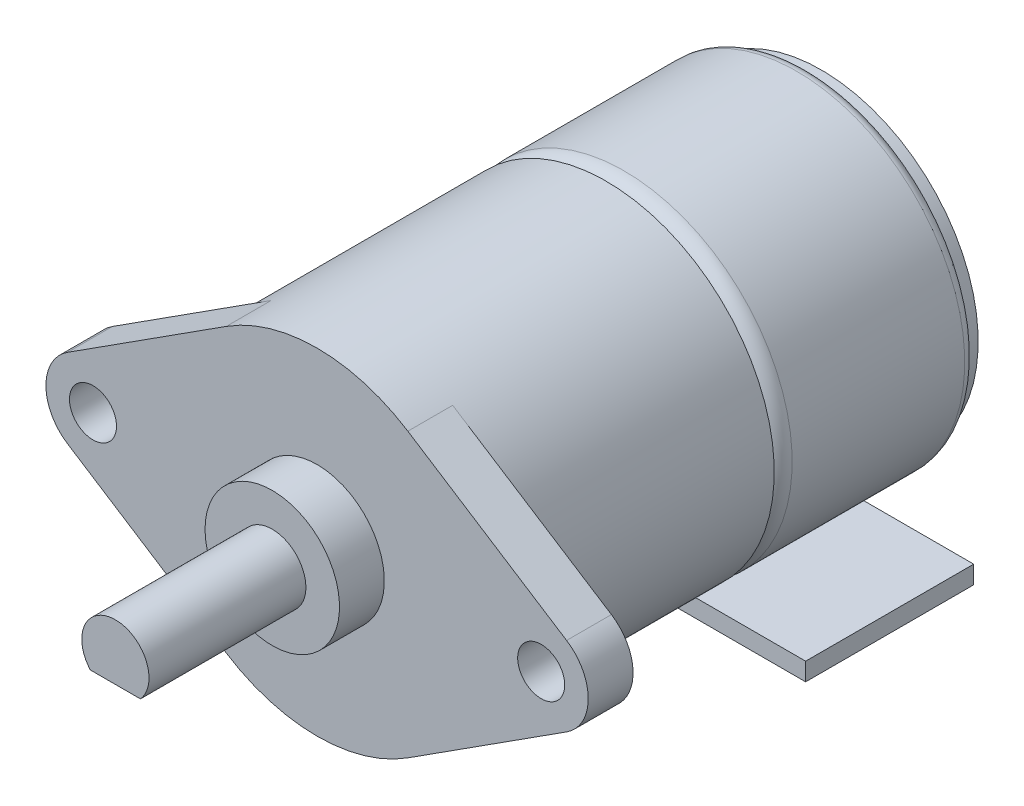
from build123d import *

# Parameters (mm, degrees)
SKETCH_2_W                = 2.236067978
SKETCH_2_H                = 1
CUT_EXTRUDE_1275_DEPTH    = 6.5
SKETCH_3_R                = 1.05
EXTRUDE_1658_DEPTH        = 2
SKETCH_4_W                = 11.5
SKETCH_4_H                = 7.5
EXTRUDE_1897_DEPTH        = 0.8
SKETCH_1932_R             = 0.75
EXTRUDE_3_DEPTH           = 0.7
EXTRUDE_3_DRAFT           = 35
EXTRUDE_3_PROFILE_2_DEPTH = 0.7
EXTRUDE_3_PROFILE_2_DRAFT = 35
EXTRUDE_3_PROFILE_3_DEPTH = 0.7
EXTRUDE_3_PROFILE_3_DRAFT = 35
EXTRUDE_3_PROFILE_4_DEPTH = 0.7
EXTRUDE_3_PROFILE_4_DRAFT = 35
EXTRUDE_3_PROFILE_5_DEPTH = 0.7
EXTRUDE_3_PROFILE_5_DRAFT = 35
EXTRUDE_3_PROFILE_6_DEPTH = 0.7
EXTRUDE_3_PROFILE_6_DRAFT = 35
EXTRUDE_3_PROFILE_7_DEPTH = 0.7
EXTRUDE_3_PROFILE_7_DRAFT = 35
EXTRUDE_3_PROFILE_8_DEPTH = 0.7
EXTRUDE_3_PROFILE_8_DRAFT = 35
EXTRUDE_4_DEPTH           = 0.01


with BuildPart() as part:
    # Эскиз1 → Motor (revolve)
    with BuildSketch(Plane(origin=(0, 0, 0), x_dir=(1, 0, 0), z_dir=(0, 1, 0))):
        with BuildLine():
            Line((0, 0), (-0.75, 0))
            Line((-0.75, 0), (-0.75, -0.5))
            Line((-0.75, -0.5), (-3, -0.5))
            Line((-3, -0.5), (-3, -1.5))
            Line((-3, -1.5), (-7, -1.5))
            Line((-7, -1.5), (-7, -2.1))
            ThreePointArc((-7, -2.1), (-7.353553391, -2.246446609), (-7.5, -2.6))
            Line((-7.5, -2.6), (-7.5, -10.3))
            ThreePointArc((-7.5, -10.3), (-7.265685425, -10.865685425), (-6.7, -11.1))
            Line((-6.7, -11.1), (-7.5, -11.1))
            Line((-7.5, -11.1), (-7.5, -24))
            Line((-7.5, -24), (-3, -24))
            Line((-3, -24), (-3, -26))
            Line((-3, -26), (-1.5, -26))
            Line((-1.5, -26), (-1.5, -33))
            Line((-1.5, -33), (0, -33))
            Line((0, -33), (0, -12))
            Line((0, -12), (0, 0))
        make_face()
    revolve(axis=Axis((0, 0, 0), (0, 0, 1)))

    # Эскиз2 → Cut-Extrude 1275 (cut)
    with BuildSketch(Plane.XY.offset(33)):
        with Locations((0, -1.5)):
            Rectangle(SKETCH_2_W, SKETCH_2_H)
    extrude(amount=-CUT_EXTRUDE_1275_DEPTH, mode=Mode.SUBTRACT)

    # Эскиз3 → Extrude 1658 (add)
    with BuildSketch(Plane.XY.offset(24)):
        with BuildLine():
            Line((4.05, 6.312487624), (11.134, 1.767496535))
            ThreePointArc((11.134, 1.767496535), (12.1, 0), (11.134, -1.767496535))
            Line((11.134, -1.767496535), (4.05, -6.312487624))
            ThreePointArc((4.05, -6.312487624), (0, -7.5), (-4.05, -6.312487624))
            Line((-4.05, -6.312487624), (-11.134, -1.767496535))
            ThreePointArc((-11.134, -1.767496535), (-12.1, 0), (-11.134, 1.767496535))
            Line((-11.134, 1.767496535), (-4.05, 6.312487624))
            ThreePointArc((-4.05, 6.312487624), (0, 7.5), (4.05, 6.312487624))
        make_face()
        with Locations((10, 0)):
            Circle(SKETCH_3_R, mode=Mode.SUBTRACT)
        with Locations((-10, 0)):
            Circle(SKETCH_3_R, mode=Mode.SUBTRACT)
    extrude(amount=-EXTRUDE_1658_DEPTH)


with BuildPart() as body_2:
    # Эскиз4 → Extrude 1897 (new body)
    with BuildSketch(Plane(origin=(0, -7.5, 0), x_dir=(-1, 0, 0), z_dir=(0, -1, 0))):
        with Locations((-2.25, -6.45)):
            Rectangle(SKETCH_4_W, SKETCH_4_H)
    extrude(amount=EXTRUDE_1897_DEPTH)


with BuildPart() as extrude_3_tool:
    # Sketch 1932 → Бобышка-Вытянуть3 (with draft: the straight prism first)
    with BuildSketch(Plane.XZ.offset(8.3)):
        with Locations((-2.25, 5.7)):
            Circle(SKETCH_1932_R)
    extrude(amount=EXTRUDE_3_DEPTH)
    # Бобышка-Вытянуть3: the draft: its side faces are tilted about the plane it starts from
    extrude_3_sides = [extrude_3_tool.faces().sort_by_distance(p)[0] for p in [
        (-3, -8.65, 5.7),
    ]]
    draft(extrude_3_sides, Plane.XZ.offset(8.3), EXTRUDE_3_DRAFT)


with BuildPart() as body_2_1:
    add(body_2.part)

    # Бобышка-Вытянуть3: add extrude_3_tool
    add(extrude_3_tool.part)


with BuildPart() as extrude_3_profile_2_tool:
    # Sketch 1932 → Бобышка-Вытянуть3 profile 2 (with draft: the straight prism first)
    with BuildSketch(Plane.XZ.offset(8.3)):
        with Locations((-0.75, 7.2)):
            Circle(SKETCH_1932_R)
    extrude(amount=EXTRUDE_3_PROFILE_2_DEPTH)
    # Бобышка-Вытянуть3 profile 2: the draft: its side faces are tilted about the plane it starts from
    extrude_3_profile_2_sides = [extrude_3_profile_2_tool.faces().sort_by_distance(p)[0] for p in [
        (-1.5, -8.65, 7.2),
    ]]
    draft(extrude_3_profile_2_sides, Plane.XZ.offset(8.3), EXTRUDE_3_PROFILE_2_DRAFT)


with BuildPart() as body_2_2:
    add(body_2_1.part)

    # Бобышка-Вытянуть3 profile 2: add extrude_3_profile_2_tool
    add(extrude_3_profile_2_tool.part)


with BuildPart() as extrude_3_profile_3_tool:
    # Sketch 1932 → Бобышка-Вытянуть3 profile 3 (with draft: the straight prism first)
    with BuildSketch(Plane.XZ.offset(8.3)):
        with Locations((0.75, 5.7)):
            Circle(SKETCH_1932_R)
    extrude(amount=EXTRUDE_3_PROFILE_3_DEPTH)
    # Бобышка-Вытянуть3 profile 3: the draft: its side faces are tilted about the plane it starts from
    extrude_3_profile_3_sides = [extrude_3_profile_3_tool.faces().sort_by_distance(p)[0] for p in [
        (0, -8.65, 5.7),
    ]]
    draft(extrude_3_profile_3_sides, Plane.XZ.offset(8.3), EXTRUDE_3_PROFILE_3_DRAFT)


with BuildPart() as body_2_3:
    add(body_2_2.part)

    # Бобышка-Вытянуть3 profile 3: add extrude_3_profile_3_tool
    add(extrude_3_profile_3_tool.part)


with BuildPart() as extrude_3_profile_4_tool:
    # Sketch 1932 → Бобышка-Вытянуть3 profile 4 (with draft: the straight prism first)
    with BuildSketch(Plane.XZ.offset(8.3)):
        with Locations((2.25, 7.2)):
            Circle(SKETCH_1932_R)
    extrude(amount=EXTRUDE_3_PROFILE_4_DEPTH)
    # Бобышка-Вытянуть3 profile 4: the draft: its side faces are tilted about the plane it starts from
    extrude_3_profile_4_sides = [extrude_3_profile_4_tool.faces().sort_by_distance(p)[0] for p in [
        (1.5, -8.65, 7.2),
    ]]
    draft(extrude_3_profile_4_sides, Plane.XZ.offset(8.3), EXTRUDE_3_PROFILE_4_DRAFT)


with BuildPart() as body_2_4:
    add(body_2_3.part)

    # Бобышка-Вытянуть3 profile 4: add extrude_3_profile_4_tool
    add(extrude_3_profile_4_tool.part)


with BuildPart() as extrude_3_profile_5_tool:
    # Sketch 1932 → Бобышка-Вытянуть3 profile 5 (with draft: the straight prism first)
    with BuildSketch(Plane.XZ.offset(8.3)):
        with Locations((7, 3.7)):
            Circle(SKETCH_1932_R)
    extrude(amount=EXTRUDE_3_PROFILE_5_DEPTH)
    # Бобышка-Вытянуть3 profile 5: the draft: its side faces are tilted about the plane it starts from
    extrude_3_profile_5_sides = [extrude_3_profile_5_tool.faces().sort_by_distance(p)[0] for p in [
        (6.25, -8.65, 3.7),
    ]]
    draft(extrude_3_profile_5_sides, Plane.XZ.offset(8.3), EXTRUDE_3_PROFILE_5_DRAFT)


with BuildPart() as body_2_5:
    add(body_2_4.part)

    # Бобышка-Вытянуть3 profile 5: add extrude_3_profile_5_tool
    add(extrude_3_profile_5_tool.part)


with BuildPart() as extrude_3_profile_6_tool:
    # Sketch 1932 → Бобышка-Вытянуть3 profile 6 (with draft: the straight prism first)
    with BuildSketch(Plane.XZ.offset(8.3)):
        with Locations((7, 5.533333333)):
            Circle(SKETCH_1932_R)
    extrude(amount=EXTRUDE_3_PROFILE_6_DEPTH)
    # Бобышка-Вытянуть3 profile 6: the draft: its side faces are tilted about the plane it starts from
    extrude_3_profile_6_sides = [extrude_3_profile_6_tool.faces().sort_by_distance(p)[0] for p in [
        (6.25, -8.65, 5.533333333),
    ]]
    draft(extrude_3_profile_6_sides, Plane.XZ.offset(8.3), EXTRUDE_3_PROFILE_6_DRAFT)


with BuildPart() as body_2_6:
    add(body_2_5.part)

    # Бобышка-Вытянуть3 profile 6: add extrude_3_profile_6_tool
    add(extrude_3_profile_6_tool.part)


with BuildPart() as extrude_3_profile_7_tool:
    # Sketch 1932 → Бобышка-Вытянуть3 profile 7 (with draft: the straight prism first)
    with BuildSketch(Plane.XZ.offset(8.3)):
        with Locations((7, 7.366666667)):
            Circle(SKETCH_1932_R)
    extrude(amount=EXTRUDE_3_PROFILE_7_DEPTH)
    # Бобышка-Вытянуть3 profile 7: the draft: its side faces are tilted about the plane it starts from
    extrude_3_profile_7_sides = [extrude_3_profile_7_tool.faces().sort_by_distance(p)[0] for p in [
        (6.25, -8.65, 7.366666667),
    ]]
    draft(extrude_3_profile_7_sides, Plane.XZ.offset(8.3), EXTRUDE_3_PROFILE_7_DRAFT)


with BuildPart() as body_2_7:
    add(body_2_6.part)

    # Бобышка-Вытянуть3 profile 7: add extrude_3_profile_7_tool
    add(extrude_3_profile_7_tool.part)


with BuildPart() as extrude_3_profile_8_tool:
    # Sketch 1932 → Бобышка-Вытянуть3 profile 8 (with draft: the straight prism first)
    with BuildSketch(Plane.XZ.offset(8.3)):
        with Locations((7, 9.2)):
            Circle(SKETCH_1932_R)
    extrude(amount=EXTRUDE_3_PROFILE_8_DEPTH)
    # Бобышка-Вытянуть3 profile 8: the draft: its side faces are tilted about the plane it starts from
    extrude_3_profile_8_sides = [extrude_3_profile_8_tool.faces().sort_by_distance(p)[0] for p in [
        (6.25, -8.65, 9.2),
    ]]
    draft(extrude_3_profile_8_sides, Plane.XZ.offset(8.3), EXTRUDE_3_PROFILE_8_DRAFT)


with BuildPart() as body_2_8:
    add(body_2_7.part)

    # Бобышка-Вытянуть3 profile 8: add extrude_3_profile_8_tool
    add(extrude_3_profile_8_tool.part)

    # Эскиз6 → Бобышка-Вытянуть4 (add)
    # profile 1 of 16: a face of its own
    with BuildSketch(Plane.XZ.offset(8.3)):
        with BuildLine():
            Line((5.183226347, 9.305128205), (5.183226347, 9.228846154))
            add(Edge.make_bspline(
                [(5.183226347, 9.228846154), (5.173106274, 9.22934332), (5.153230721, 9.23031974), (5.124252058, 9.234892324), (5.096553035, 9.241435109), (5.070356056, 9.250685891), (5.045429488, 9.262174558), (5.021872342, 9.27595185), (4.999774482, 9.292270357), (4.979340763, 9.310777707), (4.96059521, 9.330878662), (4.944407508, 9.352567247), (4.930730359, 9.375358182), (4.919296343, 9.399182322), (4.910713809, 9.424308459), (4.904345697, 9.450508582), (4.900514298, 9.4778978), (4.900102465, 9.496558949), (4.899893013, 9.506049679)],
                knots=[0, 0, 0, 0, 1.10065271, 2.161652631, 3.183658789, 4.190468796, 5.17591951, 6.163126047, 7.15150782, 8.156236427, 9.156009102, 10.134482811, 11.092018607, 12.041330605, 13.001268258, 13.972401359, 14.968799086, 16, 16, 16, 16], degree=3))
            add(Edge.make_bspline(
                [(4.899893013, 9.506049679), (4.900109439, 9.515370725), (4.900534708, 9.533686246), (4.904241722, 9.560406313), (4.909922389, 9.585903666), (4.918340243, 9.609889343), (4.928902809, 9.632609504), (4.942038744, 9.653782836), (4.957126498, 9.673921332), (4.974923245, 9.69203663), (4.993912419, 9.708677717), (5.014192696, 9.723021328), (5.035163128, 9.735374158), (5.056987523, 9.745484564), (5.079736952, 9.753148701), (5.10319331, 9.758827092), (5.127627297, 9.762073168), (5.144167936, 9.762568621), (5.152577308, 9.762820513)],
                knots=[0, 0, 0, 0, 1.111674182, 2.184400057, 3.212814286, 4.223731311, 5.211378316, 6.196328225, 7.191884489, 8.207283132, 9.220262353, 10.201199469, 11.166417575, 12.120932471, 13.06540007, 14.026332106, 14.996573967, 16, 16, 16, 16], degree=3))
            add(Edge.make_bspline(
                [(5.152577308, 9.762820513), (5.164416063, 9.762409285), (5.187885819, 9.761594047), (5.222375218, 9.75462065), (5.255790478, 9.743728994), (5.282684739, 9.730616512), (5.304353679, 9.717384889), (5.322203622, 9.705473201), (5.341418154, 9.691449296), (5.362075046, 9.675432988), (5.383903778, 9.657148454), (5.407349714, 9.637070722), (5.431979324, 9.614681279), (5.448812639, 9.598980897), (5.457535241, 9.590845353)],
                knots=[0, 0, 0, 0, 1.184416499, 2.348048165, 3.509039915, 4.696071444, 5.333504901, 6.05069495, 6.844171097, 7.714965912, 8.667477798, 9.695072654, 10.805644396, 12, 12, 12, 12], degree=3))
            Line((5.457535241, 9.590845353), (5.684508398, 9.37817508))
            Line((5.684508398, 9.37817508), (5.684508398, 9.773717949))
            Line((5.684508398, 9.773717949), (5.771687885, 9.773717949))
            Line((5.771687885, 9.773717949), (5.771687885, 9.196153846))
            Line((5.771687885, 9.196153846), (5.419905033, 9.525801282))
            add(Edge.make_bspline(
                [(5.419905033, 9.525801282), (5.411526873, 9.533827197), (5.395434141, 9.549243338), (5.371939423, 9.571047678), (5.350143106, 9.590631433), (5.330086372, 9.608121371), (5.311475849, 9.623138079), (5.294914278, 9.636464193), (5.279673911, 9.647141551), (5.262008334, 9.658729575), (5.240439628, 9.669952971), (5.214081446, 9.6795974), (5.186947685, 9.685478149), (5.168611476, 9.686183609), (5.159388206, 9.686538462)],
                knots=[0, 0, 0, 0, 1.329631726, 2.553950428, 3.673215718, 4.687767853, 5.603093632, 6.413772471, 7.123043292, 7.734684054, 8.834405432, 9.900288307, 10.943827018, 12, 12, 12, 12], degree=3))
            add(Edge.make_bspline(
                [(5.159388206, 9.686538462), (5.153588438, 9.686384067), (5.142158208, 9.686079785), (5.125399667, 9.683394344), (5.109233926, 9.679336078), (5.093611262, 9.673520801), (5.078688746, 9.665844879), (5.064448215, 9.656501344), (5.050680895, 9.6457209), (5.037772237, 9.633249877), (5.025949658, 9.619549937), (5.015476666, 9.605077047), (5.006724311, 9.589764879), (4.999549462, 9.573677992), (4.993921155, 9.556861236), (4.990021214, 9.539282083), (4.987572611, 9.520989108), (4.987241312, 9.508498116), (4.987072501, 9.502133413)],
                knots=[0, 0, 0, 0, 0.991446411, 1.95395049, 2.89581595, 3.838931463, 4.798493298, 5.75982156, 6.748411868, 7.785213223, 8.824556874, 9.840280684, 10.836137867, 11.835679398, 12.848801643, 13.863922112, 14.911575587, 16, 16, 16, 16], degree=3))
            add(Edge.make_bspline(
                [(4.987072501, 9.502133413), (4.987239299, 9.495484543), (4.987566864, 9.482427259), (4.990048006, 9.463296967), (4.993809418, 9.444921487), (4.999783361, 9.427574998), (5.006841872, 9.410881872), (5.015808949, 9.395198482), (5.026228891, 9.380264435), (5.03831124, 9.366325367), (5.051886632, 9.353594562), (5.066847651, 9.342251598), (5.08308659, 9.332405907), (5.1005368, 9.323803635), (5.119372022, 9.316820921), (5.139521114, 9.311484355), (5.160897794, 9.307261899), (5.175659878, 9.305851249), (5.183226347, 9.305128205)],
                knots=[0, 0, 0, 0, 1.030878251, 2.024474673, 2.987898669, 3.934362936, 4.864849709, 5.795128259, 6.730474222, 7.685293701, 8.650606017, 9.611896181, 10.591709709, 11.591680886, 12.625074257, 13.701333388, 14.821793024, 16, 16, 16, 16], degree=3))
        make_face()
    # profile 2 of 16: a face of its own
    with BuildSketch(Plane.XZ.offset(8.3)):
        Polygon((4.921687885, 8.749358974), (5.771687885, 9.141666667), (5.771687885, 9.05874399), (5.499251988, 8.933082933), (5.499251988, 8.54775641), (5.771687885, 8.418519631), (5.771687885, 8.33525641), (4.921687885, 8.738461538), align=None)
        Polygon((5.087362965, 8.743058894), (5.412072501, 8.589132612), (5.412072501, 8.892898638), align=None, mode=Mode.SUBTRACT)
    # profile 3 of 16: a face of its own
    with BuildSketch(Plane.XZ.offset(8.3)):
        Polygon((4.921687885, 7.524248798), (4.921687885, 7.681410256), (5.771687885, 7.681410256), (5.771687885, 7.605128205), (5.008867372, 7.605128205), (5.008867372, 7.474358974), align=None)
    # profile 4 of 16: a face of its own
    with BuildSketch(Plane.XZ.offset(8.3)):
        Polygon((4.921687885, 6.896794872), (5.771687885, 7.289102564), (5.771687885, 7.206179888), (5.499251988, 7.08051883), (5.499251988, 6.695192308), (5.771687885, 6.565955529), (5.771687885, 6.482692308), (4.921687885, 6.885897436), align=None)
        Polygon((5.087362965, 6.890494792), (5.412072501, 6.73656851), (5.412072501, 7.040334535), align=None, mode=Mode.SUBTRACT)
    # profile 5 of 16: a face of its own
    with BuildSketch(Plane.XZ.offset(8.3)):
        with BuildLine():
            Line((5.183226347, 5.6), (5.183226347, 5.523717949))
            add(Edge.make_bspline(
                [(5.183226347, 5.523717949), (5.173106274, 5.524215114), (5.153230721, 5.525191535), (5.124252058, 5.529764119), (5.096553035, 5.536306904), (5.070356056, 5.545557685), (5.045429488, 5.557046353), (5.021872342, 5.570823645), (4.999774482, 5.587142152), (4.979340763, 5.605649501), (4.96059521, 5.625750457), (4.944407508, 5.647439042), (4.930730359, 5.670229977), (4.919296343, 5.694054117), (4.910713809, 5.719180254), (4.904345697, 5.745380376), (4.900514298, 5.772769595), (4.900102465, 5.791430743), (4.899893013, 5.800921474)],
                knots=[0, 0, 0, 0, 1.10065271, 2.161652631, 3.183658789, 4.190468796, 5.17591951, 6.163126047, 7.15150782, 8.156236427, 9.156009102, 10.134482811, 11.092018607, 12.041330605, 13.001268258, 13.972401359, 14.968799086, 16, 16, 16, 16], degree=3))
            add(Edge.make_bspline(
                [(4.899893013, 5.800921474), (4.900109439, 5.81024252), (4.900534708, 5.828558041), (4.904241722, 5.855278108), (4.909922389, 5.880775461), (4.918340243, 5.904761137), (4.928902809, 5.927481298), (4.942038744, 5.94865463), (4.957126498, 5.968793127), (4.974923245, 5.986908425), (4.993912419, 6.003549512), (5.014192696, 6.017893123), (5.035163128, 6.030245953), (5.056987523, 6.040356359), (5.079736952, 6.048020496), (5.10319331, 6.053698887), (5.127627297, 6.056944963), (5.144167936, 6.057440416), (5.152577308, 6.057692308)],
                knots=[0, 0, 0, 0, 1.111674182, 2.184400057, 3.212814286, 4.223731311, 5.211378316, 6.196328225, 7.191884489, 8.207283132, 9.220262353, 10.201199469, 11.166417575, 12.120932471, 13.06540007, 14.026332106, 14.996573967, 16, 16, 16, 16], degree=3))
            add(Edge.make_bspline(
                [(5.152577308, 6.057692308), (5.164416063, 6.05728108), (5.187885819, 6.056465842), (5.222375218, 6.049492445), (5.255790478, 6.038600789), (5.282684739, 6.025488307), (5.304353679, 6.012256684), (5.322203622, 6.000344996), (5.341418154, 5.986321091), (5.362075046, 5.970304783), (5.383903778, 5.952020248), (5.407349714, 5.931942517), (5.431979324, 5.909553074), (5.448812639, 5.893852692), (5.457535241, 5.885717147)],
                knots=[0, 0, 0, 0, 1.184416499, 2.348048165, 3.509039915, 4.696071444, 5.333504901, 6.05069495, 6.844171097, 7.714965912, 8.667477798, 9.695072654, 10.805644396, 12, 12, 12, 12], degree=3))
            Line((5.457535241, 5.885717147), (5.684508398, 5.673046875))
            Line((5.684508398, 5.673046875), (5.684508398, 6.068589744))
            Line((5.684508398, 6.068589744), (5.771687885, 6.068589744))
            Line((5.771687885, 6.068589744), (5.771687885, 5.491025641))
            Line((5.771687885, 5.491025641), (5.419905033, 5.820673077))
            add(Edge.make_bspline(
                [(5.419905033, 5.820673077), (5.411526873, 5.828698992), (5.395434141, 5.844115133), (5.371939423, 5.865919473), (5.350143106, 5.885503228), (5.330086372, 5.902993166), (5.311475849, 5.918009874), (5.294914278, 5.931335988), (5.279673911, 5.942013346), (5.262008334, 5.95360137), (5.240439628, 5.964824766), (5.214081446, 5.974469195), (5.186947685, 5.980349944), (5.168611476, 5.981055404), (5.159388206, 5.981410256)],
                knots=[0, 0, 0, 0, 1.329631726, 2.553950428, 3.673215718, 4.687767853, 5.603093632, 6.413772471, 7.123043292, 7.734684054, 8.834405432, 9.900288307, 10.943827018, 12, 12, 12, 12], degree=3))
            add(Edge.make_bspline(
                [(5.159388206, 5.981410256), (5.153588438, 5.981255862), (5.142158208, 5.98095158), (5.125399667, 5.978266139), (5.109233926, 5.974207873), (5.093611262, 5.968392596), (5.078688746, 5.960716674), (5.064448215, 5.951373139), (5.050680895, 5.940592695), (5.037772237, 5.928121672), (5.025949658, 5.914421732), (5.015476666, 5.899948842), (5.006724311, 5.884636674), (4.999549462, 5.868549787), (4.993921155, 5.85173303), (4.990021214, 5.834153878), (4.987572611, 5.815860903), (4.987241312, 5.803369911), (4.987072501, 5.797005208)],
                knots=[0, 0, 0, 0, 0.991446411, 1.95395049, 2.89581595, 3.838931463, 4.798493298, 5.75982156, 6.748411868, 7.785213223, 8.824556874, 9.840280684, 10.836137867, 11.835679398, 12.848801643, 13.863922112, 14.911575587, 16, 16, 16, 16], degree=3))
            add(Edge.make_bspline(
                [(4.987072501, 5.797005208), (4.987239299, 5.790356338), (4.987566864, 5.777299054), (4.990048006, 5.758168762), (4.993809418, 5.739793282), (4.999783361, 5.722446793), (5.006841872, 5.705753667), (5.015808949, 5.690070277), (5.026228891, 5.67513623), (5.03831124, 5.661197162), (5.051886632, 5.648466356), (5.066847651, 5.637123393), (5.08308659, 5.627277702), (5.1005368, 5.61867543), (5.119372022, 5.611692716), (5.139521114, 5.606356149), (5.160897794, 5.602133694), (5.175659878, 5.600723044), (5.183226347, 5.6)],
                knots=[0, 0, 0, 0, 1.030878251, 2.024474673, 2.987898669, 3.934362936, 4.864849709, 5.795128259, 6.730474222, 7.685293701, 8.650606017, 9.611896181, 10.591709709, 11.591680886, 12.625074257, 13.701333388, 14.821793024, 16, 16, 16, 16], degree=3))
        make_face()
    # profile 6 of 16: a face of its own
    with BuildSketch(Plane.XZ.offset(8.3)):
        with BuildLine():
            Line((4.921687885, 4.891666667), (4.921687885, 5.057512019))
            add(Edge.make_bspline(
                [(4.921687885, 5.057512019), (4.921729896, 5.065630492), (4.921811322, 5.081366113), (4.9231035, 5.104246237), (4.924821328, 5.125684119), (4.927702893, 5.145641874), (4.930690696, 5.164249365), (4.935076075, 5.181317687), (4.939919886, 5.196989808), (4.947372746, 5.215808817), (4.958947132, 5.237161562), (4.976113047, 5.260111768), (4.996693592, 5.280061486), (5.020146747, 5.297024661), (5.045947875, 5.310637969), (5.073541857, 5.320362002), (5.102464456, 5.326609091), (5.122293572, 5.327243488), (5.132314888, 5.327564103)],
                knots=[0, 0, 0, 0, 1.00128172, 1.940733171, 2.826250472, 3.653024905, 4.427672124, 5.149348099, 5.824709082, 6.450061444, 7.643590664, 8.808605388, 9.972104426, 11.165284501, 12.367876273, 13.557044126, 14.765369432, 16, 16, 16, 16], degree=3))
            add(Edge.make_bspline(
                [(5.132314888, 5.327564103), (5.141701525, 5.327297054), (5.160147151, 5.326772279), (5.187079484, 5.321815329), (5.212690558, 5.313947941), (5.236958454, 5.303074894), (5.259431423, 5.28906558), (5.28003985, 5.272280453), (5.29800485, 5.252113258), (5.308044519, 5.23699586), (5.313144215, 5.229316907)],
                knots=[0, 0, 0, 0, 1.044641374, 2.052818814, 3.038628718, 4.023282556, 5.005660861, 5.98021751, 6.974042014, 8, 8, 8, 8], degree=3))
            add(Edge.make_bspline(
                [(5.313144215, 5.229316907), (5.31685263, 5.238972078), (5.323947745, 5.257444813), (5.336472213, 5.282880656), (5.350143866, 5.304715331), (5.364843335, 5.323375369), (5.380921481, 5.33925023), (5.39850893, 5.352998779), (5.417591286, 5.364884666), (5.438098413, 5.374999475), (5.459856464, 5.382944783), (5.482599686, 5.388784474), (5.506240892, 5.392238779), (5.522284288, 5.392709999), (5.530411844, 5.392948718)],
                knots=[0, 0, 0, 0, 1.272586185, 2.434772614, 3.483318042, 4.437947805, 5.351807173, 6.25737843, 7.180033415, 8.1141739, 9.066731021, 10.025721652, 10.999834114, 12, 12, 12, 12], degree=3))
            add(Edge.make_bspline(
                [(5.530411844, 5.392948718), (5.538709546, 5.392711536), (5.555035509, 5.392244873), (5.579018416, 5.388800425), (5.601939819, 5.382972364), (5.623937413, 5.374930785), (5.644965078, 5.36450756), (5.664946637, 5.351639506), (5.683923663, 5.336507263), (5.701929646, 5.319405383), (5.718405686, 5.300346676), (5.732569525, 5.279342753), (5.744748407, 5.256969021), (5.754664019, 5.232939453), (5.762313907, 5.20731539), (5.767643775, 5.180111092), (5.771241058, 5.151371361), (5.771536416, 5.131648848), (5.771687885, 5.121534455)],
                knots=[0, 0, 0, 0, 0.978680899, 1.925582087, 2.851223405, 3.764209995, 4.683484765, 5.614004905, 6.562443559, 7.542772147, 8.539900013, 9.527881485, 10.525548727, 11.540192123, 12.58875426, 13.674701727, 14.807505862, 16, 16, 16, 16], degree=3))
            Line((5.771687885, 5.121534455), (5.771687885, 4.891666667))
            Line((5.771687885, 4.891666667), (4.921687885, 4.891666667))
        make_face()
        with BuildLine():
            Line((5.008867372, 4.967948718), (5.28130327, 4.967948718))
            Line((5.28130327, 4.967948718), (5.28130327, 5.019200721))
            add(Edge.make_bspline(
                [(5.28130327, 5.019200721), (5.281206146, 5.026692571), (5.281018482, 5.041168353), (5.280480913, 5.062131756), (5.278975675, 5.08159069), (5.277470866, 5.099511561), (5.275024188, 5.115866163), (5.272111792, 5.130618217), (5.269031732, 5.14399939), (5.263793117, 5.159430062), (5.256053503, 5.176935943), (5.244030592, 5.195585728), (5.22972181, 5.212103369), (5.213057021, 5.225884323), (5.194906136, 5.237262557), (5.175428501, 5.245233368), (5.155016081, 5.250547271), (5.140975869, 5.251034615), (5.13384734, 5.251282051)],
                knots=[0, 0, 0, 0, 1.156917035, 2.235399477, 3.236897345, 4.169954739, 5.01148057, 5.788325709, 6.491867502, 7.129259015, 8.302032419, 9.437271567, 10.542795419, 11.662606952, 12.764338259, 13.836858145, 14.901724648, 16, 16, 16, 16], degree=3))
            add(Edge.make_bspline(
                [(5.13384734, 5.251282051), (5.129129035, 5.251156419), (5.119873562, 5.250909976), (5.106337387, 5.248818291), (5.093618347, 5.245429205), (5.081594372, 5.240839469), (5.070564286, 5.234569208), (5.060001043, 5.227301152), (5.05053733, 5.218327706), (5.041717527, 5.208186914), (5.033823833, 5.19658404), (5.027285131, 5.183269099), (5.021358894, 5.168586302), (5.016971877, 5.152137298), (5.013114184, 5.134262916), (5.010690369, 5.114721129), (5.009130621, 5.09363577), (5.008957079, 5.079026264), (5.008867372, 5.071474359)],
                knots=[0, 0, 0, 0, 0.911708768, 1.788416306, 2.640049961, 3.452993646, 4.268229297, 5.087074648, 5.92553149, 6.781184137, 7.681934069, 8.628939405, 9.643570426, 10.73771997, 11.914765019, 13.176320755, 14.540391495, 16, 16, 16, 16], degree=3))
            Line((5.008867372, 5.071474359), (5.008867372, 4.967948718))
        make_face(mode=Mode.SUBTRACT)
        with BuildLine():
            Line((5.368482757, 4.967948718), (5.684508398, 4.967948718))
            Line((5.684508398, 4.967948718), (5.684508398, 5.076582532))
            add(Edge.make_bspline(
                [(5.684508398, 5.076582532), (5.684405935, 5.084357744), (5.684208452, 5.099343439), (5.683745313, 5.120997247), (5.681993329, 5.141014608), (5.680377131, 5.159458668), (5.677613502, 5.176280477), (5.675005355, 5.19160943), (5.671133746, 5.20519389), (5.665812676, 5.221090852), (5.657294304, 5.23885998), (5.644849042, 5.25827844), (5.629489668, 5.275211035), (5.612021289, 5.289746088), (5.593080235, 5.301741044), (5.572914124, 5.31034856), (5.55191515, 5.315697578), (5.537594042, 5.316342987), (5.530411844, 5.316666667)],
                knots=[0, 0, 0, 0, 1.160376723, 2.23647316, 3.230273494, 4.158083346, 4.997711197, 5.773399541, 6.476071462, 7.102777513, 8.27340052, 9.405620712, 10.53304798, 11.669441455, 12.787990954, 13.865552736, 14.929550474, 16, 16, 16, 16], degree=3))
            add(Edge.make_bspline(
                [(5.530411844, 5.316666667), (5.525920507, 5.316599818), (5.51701028, 5.316467199), (5.503917848, 5.314458056), (5.491229211, 5.311551463), (5.478891494, 5.307723396), (5.467112139, 5.302371964), (5.455845971, 5.295811558), (5.444866039, 5.288302007), (5.430805284, 5.276716191), (5.414806095, 5.259618481), (5.39933539, 5.235320728), (5.386657297, 5.207845865), (5.381297542, 5.187872045), (5.378528831, 5.177554087)],
                knots=[0, 0, 0, 0, 0.723302347, 1.434937762, 2.129609326, 2.821140842, 3.513216847, 4.209993937, 4.920569932, 5.655069131, 7.14393391, 8.6716197, 10.280644748, 12, 12, 12, 12], degree=3))
            add(Edge.make_bspline(
                [(5.378528831, 5.177554087), (5.377689739, 5.173418449), (5.375870415, 5.164451534), (5.373949973, 5.149829693), (5.372239029, 5.133136696), (5.370973463, 5.114333997), (5.369665302, 5.093397807), (5.36915656, 5.070283413), (5.368549597, 5.045085208), (5.368505607, 5.027601346), (5.368482757, 5.018519631)],
                knots=[0, 0, 0, 0, 0.634451884, 1.375622551, 2.216452059, 3.157844607, 4.20941857, 5.370758133, 6.634282058, 8, 8, 8, 8], degree=3))
            Line((5.368482757, 5.018519631), (5.368482757, 4.967948718))
        make_face(mode=Mode.SUBTRACT)
    # profile 7 of 16: a face of its own
    with BuildSketch(Plane.XZ.offset(8.3)):
        Polygon((4.921687885, 4.015274439), (4.921687885, 4.172435897), (5.771687885, 4.172435897), (5.771687885, 4.096153846), (5.008867372, 4.096153846), (5.008867372, 3.965384615), align=None)
    # profile 8 of 16: a face of its own
    with BuildSketch(Plane.XZ.offset(8.3)):
        with BuildLine():
            Line((4.921687885, 3.23525641), (4.921687885, 3.401101763))
            add(Edge.make_bspline(
                [(4.921687885, 3.401101763), (4.921729896, 3.409220236), (4.921811322, 3.424955856), (4.9231035, 3.447835981), (4.924821328, 3.469273862), (4.927702893, 3.489231618), (4.930690696, 3.507839109), (4.935076075, 3.52490743), (4.939919886, 3.540579551), (4.947372746, 3.559398561), (4.958947132, 3.580751306), (4.976113047, 3.603701511), (4.996693592, 3.62365123), (5.020146747, 3.640614404), (5.045947875, 3.654227713), (5.073541857, 3.663951745), (5.102464456, 3.670198834), (5.122293572, 3.670833232), (5.132314888, 3.671153846)],
                knots=[0, 0, 0, 0, 1.00128172, 1.940733171, 2.826250472, 3.653024905, 4.427672124, 5.149348099, 5.824709082, 6.450061444, 7.643590664, 8.808605388, 9.972104426, 11.165284501, 12.367876273, 13.557044126, 14.765369432, 16, 16, 16, 16], degree=3))
            add(Edge.make_bspline(
                [(5.132314888, 3.671153846), (5.141701525, 3.670886798), (5.160147151, 3.670362023), (5.187079484, 3.665405073), (5.212690558, 3.657537685), (5.236958454, 3.646664637), (5.259431423, 3.632655324), (5.28003985, 3.615870197), (5.29800485, 3.595703001), (5.308044519, 3.580585604), (5.313144215, 3.572906651)],
                knots=[0, 0, 0, 0, 1.044641374, 2.052818814, 3.038628718, 4.023282556, 5.005660861, 5.98021751, 6.974042014, 8, 8, 8, 8], degree=3))
            add(Edge.make_bspline(
                [(5.313144215, 3.572906651), (5.31685263, 3.582561822), (5.323947745, 3.601034557), (5.336472213, 3.626470399), (5.350143866, 3.648305075), (5.364843335, 3.666965112), (5.380921481, 3.682839974), (5.39850893, 3.696588522), (5.417591286, 3.70847441), (5.438098413, 3.718589218), (5.459856464, 3.726534527), (5.482599686, 3.732374218), (5.506240892, 3.735828522), (5.522284288, 3.736299742), (5.530411844, 3.736538462)],
                knots=[0, 0, 0, 0, 1.272586185, 2.434772614, 3.483318042, 4.437947805, 5.351807173, 6.25737843, 7.180033415, 8.1141739, 9.066731021, 10.025721652, 10.999834114, 12, 12, 12, 12], degree=3))
            add(Edge.make_bspline(
                [(5.530411844, 3.736538462), (5.538709546, 3.736301279), (5.555035509, 3.735834617), (5.579018416, 3.732390169), (5.601939819, 3.726562108), (5.623937413, 3.718520529), (5.644965078, 3.708097304), (5.664946637, 3.695229249), (5.683923663, 3.680097007), (5.701929646, 3.662995127), (5.718405686, 3.643936419), (5.732569525, 3.622932497), (5.744748407, 3.600558765), (5.754664019, 3.576529196), (5.762313907, 3.550905134), (5.767643775, 3.523700836), (5.771241058, 3.494961104), (5.771536416, 3.475238592), (5.771687885, 3.465124199)],
                knots=[0, 0, 0, 0, 0.978680899, 1.925582087, 2.851223405, 3.764209995, 4.683484765, 5.614004905, 6.562443559, 7.542772147, 8.539900013, 9.527881485, 10.525548727, 11.540192123, 12.58875426, 13.674701727, 14.807505862, 16, 16, 16, 16], degree=3))
            Line((5.771687885, 3.465124199), (5.771687885, 3.23525641))
            Line((5.771687885, 3.23525641), (4.921687885, 3.23525641))
        make_face()
        with BuildLine():
            Line((5.008867372, 3.311538462), (5.28130327, 3.311538462))
            Line((5.28130327, 3.311538462), (5.28130327, 3.362790465))
            add(Edge.make_bspline(
                [(5.28130327, 3.362790465), (5.281206146, 3.370282315), (5.281018482, 3.384758097), (5.280480913, 3.4057215), (5.278975675, 3.425180434), (5.277470866, 3.443101305), (5.275024188, 3.459455906), (5.272111792, 3.474207961), (5.269031732, 3.487589134), (5.263793117, 3.503019805), (5.256053503, 3.520525687), (5.244030592, 3.539175472), (5.22972181, 3.555693113), (5.213057021, 3.569474066), (5.194906136, 3.580852301), (5.175428501, 3.588823112), (5.155016081, 3.594137014), (5.140975869, 3.594624359), (5.13384734, 3.594871795)],
                knots=[0, 0, 0, 0, 1.156917035, 2.235399477, 3.236897345, 4.169954739, 5.01148057, 5.788325709, 6.491867502, 7.129259015, 8.302032419, 9.437271567, 10.542795419, 11.662606952, 12.764338259, 13.836858145, 14.901724648, 16, 16, 16, 16], degree=3))
            add(Edge.make_bspline(
                [(5.13384734, 3.594871795), (5.129129035, 3.594746162), (5.119873562, 3.59449972), (5.106337387, 3.592408034), (5.093618347, 3.589018948), (5.081594372, 3.584429212), (5.070564286, 3.578158952), (5.060001043, 3.570890896), (5.05053733, 3.561917449), (5.041717527, 3.551776658), (5.033823833, 3.540173783), (5.027285131, 3.526858842), (5.021358894, 3.512176046), (5.016971877, 3.495727042), (5.013114184, 3.477852659), (5.010690369, 3.458310873), (5.009130621, 3.437225513), (5.008957079, 3.422616008), (5.008867372, 3.415064103)],
                knots=[0, 0, 0, 0, 0.911708768, 1.788416306, 2.640049961, 3.452993646, 4.268229297, 5.087074648, 5.92553149, 6.781184137, 7.681934069, 8.628939405, 9.643570426, 10.73771997, 11.914765019, 13.176320755, 14.540391495, 16, 16, 16, 16], degree=3))
            Line((5.008867372, 3.415064103), (5.008867372, 3.311538462))
        make_face(mode=Mode.SUBTRACT)
        with BuildLine():
            Line((5.368482757, 3.311538462), (5.684508398, 3.311538462))
            Line((5.684508398, 3.311538462), (5.684508398, 3.420172276))
            add(Edge.make_bspline(
                [(5.684508398, 3.420172276), (5.684405935, 3.427947487), (5.684208452, 3.442933183), (5.683745313, 3.464586991), (5.681993329, 3.484604351), (5.680377131, 3.503048412), (5.677613502, 3.519870221), (5.675005355, 3.535199173), (5.671133746, 3.548783634), (5.665812676, 3.564680595), (5.657294304, 3.582449724), (5.644849042, 3.601868183), (5.629489668, 3.618800779), (5.612021289, 3.633335831), (5.593080235, 3.645330788), (5.572914124, 3.653938304), (5.55191515, 3.659287321), (5.537594042, 3.65993273), (5.530411844, 3.66025641)],
                knots=[0, 0, 0, 0, 1.160376723, 2.23647316, 3.230273494, 4.158083346, 4.997711197, 5.773399541, 6.476071462, 7.102777513, 8.27340052, 9.405620712, 10.53304798, 11.669441455, 12.787990954, 13.865552736, 14.929550474, 16, 16, 16, 16], degree=3))
            add(Edge.make_bspline(
                [(5.530411844, 3.66025641), (5.525920507, 3.660189562), (5.51701028, 3.660056943), (5.503917848, 3.6580478), (5.491229211, 3.655141206), (5.478891494, 3.651313139), (5.467112139, 3.645961708), (5.455845971, 3.639401301), (5.444866039, 3.631891751), (5.430805284, 3.620305934), (5.414806095, 3.603208225), (5.39933539, 3.578910472), (5.386657297, 3.551435609), (5.381297542, 3.531461789), (5.378528831, 3.52114383)],
                knots=[0, 0, 0, 0, 0.723302347, 1.434937762, 2.129609326, 2.821140842, 3.513216847, 4.209993937, 4.920569932, 5.655069131, 7.14393391, 8.6716197, 10.280644748, 12, 12, 12, 12], degree=3))
            add(Edge.make_bspline(
                [(5.378528831, 3.52114383), (5.377689739, 3.517008193), (5.375870415, 3.508041277), (5.373949973, 3.493419436), (5.372239029, 3.47672644), (5.370973463, 3.457923741), (5.369665302, 3.436987551), (5.36915656, 3.413873156), (5.368549597, 3.388674951), (5.368505607, 3.371191089), (5.368482757, 3.362109375)],
                knots=[0, 0, 0, 0, 0.634451884, 1.375622551, 2.216452059, 3.157844607, 4.20941857, 5.370758133, 6.634282058, 8, 8, 8, 8], degree=3))
            Line((5.368482757, 3.362109375), (5.368482757, 3.311538462))
        make_face(mode=Mode.SUBTRACT)
    # profile 9 of 16: a face of its own
    with BuildSketch(Plane.XZ.offset(8.3)):
        with BuildLine():
            Line((-3.08974359, 8.993200129), (-2.933653846, 8.993200129))
            add(Edge.make_bspline(
                [(-2.933653846, 8.993200129), (-2.926013051, 8.993159958), (-2.911203289, 8.993082095), (-2.889667416, 8.991874522), (-2.86949626, 8.990227969), (-2.850683969, 8.987615377), (-2.833239237, 8.98446297), (-2.817109491, 8.980645413), (-2.802346023, 8.976067901), (-2.784720255, 8.968788751), (-2.764624104, 8.957972027), (-2.742864471, 8.941988355), (-2.724257788, 8.922438077), (-2.708215201, 8.900384899), (-2.69546066, 8.876125294), (-2.686233392, 8.850237479), (-2.680391591, 8.823055367), (-2.679790807, 8.804394069), (-2.679487179, 8.79496295)],
                knots=[0, 0, 0, 0, 1.001505555, 1.941167018, 2.826882275, 3.653841531, 4.429895133, 5.150066043, 5.825578002, 6.45369114, 7.647487171, 8.808567382, 9.977351308, 11.170798116, 12.373658725, 13.556498008, 14.765093433, 16, 16, 16, 16], degree=3))
            add(Edge.make_bspline(
                [(-2.679487179, 8.79496295), (-2.679737058, 8.78612808), (-2.680228093, 8.768766727), (-2.684923581, 8.743373788), (-2.692274591, 8.719202081), (-2.702492933, 8.696339821), (-2.71577339, 8.675303567), (-2.731512434, 8.65592362), (-2.750501417, 8.639020522), (-2.764728443, 8.629570715), (-2.771955128, 8.624770642)],
                knots=[0, 0, 0, 0, 1.044552857, 2.05264487, 3.044412934, 4.028983338, 5.005914585, 5.980388656, 6.974128949, 8, 8, 8, 8], degree=3))
            add(Edge.make_bspline(
                [(-2.771955128, 8.624770642), (-2.76286703, 8.621281499), (-2.745479248, 8.614605905), (-2.721551017, 8.602803513), (-2.700935052, 8.58996646), (-2.683472847, 8.575947751), (-2.668538526, 8.560837166), (-2.655497854, 8.54441314), (-2.644370683, 8.526461424), (-2.6348363, 8.507169187), (-2.627396585, 8.486733423), (-2.621824949, 8.465345817), (-2.618632389, 8.443083061), (-2.618178071, 8.427932117), (-2.617948718, 8.420283462)],
                knots=[0, 0, 0, 0, 1.27268992, 2.434971085, 3.483601985, 4.442670788, 5.356604649, 6.2567628, 7.179492994, 8.113709626, 9.066344395, 10.018646069, 10.999752585, 12, 12, 12, 12], degree=3))
            add(Edge.make_bspline(
                [(-2.617948718, 8.420283462), (-2.618171997, 8.412473892), (-2.618611305, 8.397108342), (-2.621852441, 8.37453574), (-2.627340237, 8.352964324), (-2.634899356, 8.332254568), (-2.644765028, 8.312446537), (-2.65677142, 8.293517791), (-2.671087206, 8.275658515), (-2.687101576, 8.258670259), (-2.705218638, 8.243395336), (-2.724765096, 8.229791746), (-2.745987112, 8.218604075), (-2.768536139, 8.209206127), (-2.792665126, 8.202027339), (-2.818265722, 8.197005036), (-2.845315848, 8.193621027), (-2.863878077, 8.193342809), (-2.873397436, 8.193200129)],
                knots=[0, 0, 0, 0, 0.978564426, 1.925352924, 2.850884081, 3.763762016, 4.682927383, 5.618979971, 6.567305752, 7.547517671, 8.540179244, 9.531824382, 10.526200242, 11.540722885, 12.589160233, 13.674978461, 14.80764778, 16, 16, 16, 16], degree=3))
            Line((-2.873397436, 8.193200129), (-3.08974359, 8.193200129))
            Line((-3.08974359, 8.193200129), (-3.08974359, 8.993200129))
        make_face()
        with BuildLine():
            Line((-3.017948718, 8.911148847), (-3.017948718, 8.654738591))
            Line((-3.017948718, 8.654738591), (-2.969711538, 8.654738591))
            add(Edge.make_bspline(
                [(-2.969711538, 8.654738591), (-2.962660385, 8.654830002), (-2.94903612, 8.655006626), (-2.929305858, 8.655512573), (-2.910991568, 8.656929269), (-2.894124864, 8.658345557), (-2.878732305, 8.66064832), (-2.864847994, 8.663389377), (-2.852254029, 8.666288326), (-2.837730704, 8.671218495), (-2.821256887, 8.678504821), (-2.803695035, 8.689812669), (-2.78821287, 8.703281092), (-2.775139228, 8.718821884), (-2.764439463, 8.735934155), (-2.757007757, 8.75434487), (-2.751968377, 8.773595186), (-2.75151317, 8.786810787), (-2.751282051, 8.793520642)],
                knots=[0, 0, 0, 0, 1.156816544, 2.235205308, 3.236616184, 4.169592532, 5.011045266, 5.787822928, 6.49130361, 7.128639758, 8.301311294, 9.436451833, 10.541879658, 11.654887649, 12.756523258, 13.837046038, 14.901820046, 16, 16, 16, 16], degree=3))
            add(Edge.make_bspline(
                [(-2.751282051, 8.793520642), (-2.751402321, 8.797960818), (-2.751638243, 8.806670709), (-2.753570427, 8.819367704), (-2.756854444, 8.831309133), (-2.761072568, 8.842658644), (-2.766967125, 8.853061353), (-2.773907346, 8.862876941), (-2.782292646, 8.871771139), (-2.791837175, 8.880084167), (-2.802810574, 8.887454345), (-2.815206298, 8.893909377), (-2.829192053, 8.899107268), (-2.844532134, 8.903659532), (-2.861462668, 8.906856856), (-2.879788281, 8.909520488), (-2.899659073, 8.910876543), (-2.913406525, 8.911056055), (-2.920512821, 8.911148847)],
                knots=[0, 0, 0, 0, 0.91205012, 1.789085906, 2.630437955, 3.453916878, 4.269457761, 5.079663411, 5.91843418, 6.774407191, 7.675494373, 8.627863946, 9.638891023, 10.736472738, 11.911756761, 13.175263542, 14.539845004, 16, 16, 16, 16], degree=3))
            Line((-2.920512821, 8.911148847), (-3.017948718, 8.911148847))
        make_face(mode=Mode.SUBTRACT)
        with BuildLine():
            Line((-3.017948718, 8.572687309), (-3.017948718, 8.275251411))
            Line((-3.017948718, 8.275251411), (-2.915705128, 8.275251411))
            add(Edge.make_bspline(
                [(-2.915705128, 8.275251411), (-2.908386517, 8.275339125), (-2.894280857, 8.275508181), (-2.873914862, 8.27606008), (-2.855038724, 8.277315457), (-2.837738579, 8.279291651), (-2.821827618, 8.281435297), (-2.807496715, 8.284317875), (-2.794629699, 8.287620495), (-2.779709857, 8.292725448), (-2.762909055, 8.30065607), (-2.744803717, 8.312613608), (-2.728706295, 8.326858935), (-2.715036522, 8.343346001), (-2.703833553, 8.361273162), (-2.695683735, 8.380277813), (-2.690657253, 8.400045934), (-2.690048757, 8.41352404), (-2.68974359, 8.420283462)],
                knots=[0, 0, 0, 0, 1.160039823, 2.235823828, 3.228722157, 4.157150951, 4.99529583, 5.772374946, 6.472645482, 7.099169577, 8.269452708, 9.405989375, 10.527446681, 11.663510218, 12.788923519, 13.866172445, 14.929861265, 16, 16, 16, 16], degree=3))
            add(Edge.make_bspline(
                [(-2.68974359, 8.420283462), (-2.689806699, 8.424510512), (-2.6899319, 8.432896428), (-2.691820041, 8.445220043), (-2.694566068, 8.457157386), (-2.69811611, 8.468740869), (-2.703286274, 8.47976107), (-2.709322056, 8.49043594), (-2.716398948, 8.500779593), (-2.727426186, 8.513856679), (-2.743465497, 8.528923425), (-2.766255617, 8.543674854), (-2.792169285, 8.555571496), (-2.81096414, 8.560622805), (-2.820673077, 8.56323218)],
                knots=[0, 0, 0, 0, 0.723448775, 1.435228256, 2.130040452, 2.821711965, 3.505591119, 4.210454504, 4.921174351, 5.648778258, 7.137944449, 8.670945889, 10.280296675, 12, 12, 12, 12], degree=3))
            add(Edge.make_bspline(
                [(-2.820673077, 8.56323218), (-2.824565442, 8.564021914), (-2.833004891, 8.565734219), (-2.846766624, 8.567541694), (-2.86247768, 8.569151993), (-2.880174337, 8.570343115), (-2.899878987, 8.571574325), (-2.921633711, 8.572053141), (-2.945349669, 8.572624401), (-2.961805068, 8.572665803), (-2.970352564, 8.572687309)],
                knots=[0, 0, 0, 0, 0.634451884, 1.375622551, 2.216452059, 3.157844607, 4.20941857, 5.370758133, 6.634282058, 8, 8, 8, 8], degree=3))
            Line((-2.970352564, 8.572687309), (-3.017948718, 8.572687309))
        make_face(mode=Mode.SUBTRACT)
    # profile 10 of 16: a face of its own
    with BuildSketch(Plane.XZ.offset(8.3)):
        Polygon((-2.355608974, 8.993200129), (-2.207692308, 8.993200129), (-2.207692308, 8.193200129), (-2.279487179, 8.193200129), (-2.279487179, 8.911148847), (-2.402564103, 8.911148847), align=None)
    # profile 11 of 16: a face of its own
    with BuildSketch(Plane.XZ.offset(8.3)):
        Polygon((-1.202564103, 8.993200129), (-0.833333333, 8.193200129), (-0.911378205, 8.193200129), (-1.029647436, 8.449610386), (-1.392307692, 8.449610386), (-1.513942308, 8.193200129), (-1.592307692, 8.193200129), (-1.212820513, 8.993200129), align=None)
        Polygon((-1.20849359, 8.837270642), (-1.353365385, 8.531661668), (-1.067467949, 8.531661668), align=None, mode=Mode.SUBTRACT)
    # profile 12 of 16: a face of its own
    with BuildSketch(Plane.XZ.offset(8.3)):
        with BuildLine():
            Line((-0.658974359, 8.747046283), (-0.730769231, 8.747046283))
            add(Edge.make_bspline(
                [(-0.730769231, 8.747046283), (-0.73030131, 8.756571057), (-0.729382326, 8.775277461), (-0.725078717, 8.802551496), (-0.718920803, 8.828621165), (-0.710214184, 8.853277145), (-0.699401321, 8.876737444), (-0.686434458, 8.898908876), (-0.671075863, 8.919706862), (-0.653657181, 8.938938598), (-0.634738635, 8.956581471), (-0.614325849, 8.971816955), (-0.592875557, 8.984689566), (-0.570452837, 8.995450992), (-0.546804708, 9.003528671), (-0.522145769, 9.009522189), (-0.496367681, 9.013128211), (-0.478804247, 9.013515819), (-0.469871795, 9.01371295)],
                knots=[0, 0, 0, 0, 1.10065271, 2.161652631, 3.183658789, 4.190468796, 5.17591951, 6.163126047, 7.15150782, 8.156236427, 9.156009102, 10.134482811, 11.092018607, 12.041330605, 13.001268258, 13.972401359, 14.968799086, 16, 16, 16, 16], degree=3))
            add(Edge.make_bspline(
                [(-0.469871795, 9.01371295), (-0.461099664, 9.013507588), (-0.443862739, 9.01310406), (-0.418705707, 9.009638682), (-0.394756611, 9.004211118), (-0.372062265, 8.996596166), (-0.350803736, 8.986359725), (-0.330821326, 8.974063145), (-0.31187714, 8.959841469), (-0.294824161, 8.943097741), (-0.279165172, 8.92522291), (-0.265656085, 8.906139961), (-0.254087362, 8.88643041), (-0.244444463, 8.865943963), (-0.237345917, 8.844487728), (-0.231956613, 8.822374082), (-0.228910347, 8.799374125), (-0.228442821, 8.783806913), (-0.228205128, 8.775892437)],
                knots=[0, 0, 0, 0, 1.111607364, 2.184268762, 3.212621178, 4.221274766, 5.211760367, 6.196651075, 7.1921475, 8.207485113, 9.220403448, 10.201281604, 11.166441695, 12.114753415, 13.065576456, 14.026450734, 14.996634279, 16, 16, 16, 16], degree=3))
            add(Edge.make_bspline(
                [(-0.228205128, 8.775892437), (-0.22859216, 8.764750075), (-0.229359431, 8.742660883), (-0.235922717, 8.710200343), (-0.246173348, 8.678750419), (-0.258515601, 8.653439035), (-0.270966445, 8.633042808), (-0.282186447, 8.616249961), (-0.295321261, 8.598168711), (-0.310562061, 8.578859606), (-0.327593574, 8.558171399), (-0.346570069, 8.536116588), (-0.367626865, 8.512923041), (-0.382405951, 8.497081761), (-0.390064103, 8.488873206)],
                knots=[0, 0, 0, 0, 1.184426356, 2.348067706, 3.509069118, 4.696110526, 5.333549288, 6.050745305, 6.844228056, 7.710549037, 8.667450064, 9.695053472, 10.805634456, 12, 12, 12, 12], degree=3))
            Line((-0.390064103, 8.488873206), (-0.590224359, 8.275251411))
            Line((-0.590224359, 8.275251411), (-0.217948718, 8.275251411))
            Line((-0.217948718, 8.275251411), (-0.217948718, 8.193200129))
            Line((-0.217948718, 8.193200129), (-0.761538462, 8.193200129))
            Line((-0.761538462, 8.193200129), (-0.451282051, 8.524289873))
            add(Edge.make_bspline(
                [(-0.451282051, 8.524289873), (-0.443728249, 8.5321752), (-0.42921894, 8.5473213), (-0.408697208, 8.569433976), (-0.390265439, 8.589948157), (-0.373804321, 8.608825082), (-0.359670948, 8.626340869), (-0.347128723, 8.64192823), (-0.337079446, 8.656272105), (-0.326173069, 8.672898531), (-0.315609874, 8.693198489), (-0.306532764, 8.718006189), (-0.300997941, 8.743543847), (-0.300333979, 8.760801455), (-0.3, 8.76948218)],
                knots=[0, 0, 0, 0, 1.329631726, 2.553950428, 3.673215718, 4.687767853, 5.603093632, 6.413772471, 7.123043292, 7.734684054, 8.834405432, 9.900288307, 10.943827018, 12, 12, 12, 12], degree=3))
            add(Edge.make_bspline(
                [(-0.3, 8.76948218), (-0.300145313, 8.774940786), (-0.300431696, 8.785698649), (-0.302959169, 8.801471394), (-0.306778714, 8.816686208), (-0.312251915, 8.831389893), (-0.319476313, 8.845434613), (-0.328270229, 8.858837466), (-0.338416529, 8.871794943), (-0.350153962, 8.883944269), (-0.363048023, 8.895071401), (-0.376669566, 8.904928335), (-0.391081019, 8.913165846), (-0.406221618, 8.919918646), (-0.422049154, 8.925215876), (-0.438594238, 8.928886408), (-0.455811156, 8.931190976), (-0.467567384, 8.931502787), (-0.473557692, 8.931661668)],
                knots=[0, 0, 0, 0, 0.991446411, 1.95395049, 2.89581595, 3.838931463, 4.798493298, 5.75982156, 6.748411868, 7.785213223, 8.824556874, 9.840280684, 10.836137867, 11.835679398, 12.848801643, 13.863922112, 14.911575587, 16, 16, 16, 16], degree=3))
            add(Edge.make_bspline(
                [(-0.473557692, 8.931661668), (-0.479813883, 8.931498232), (-0.492100008, 8.93117727), (-0.510138644, 8.92893209), (-0.527346821, 8.925058755), (-0.543767828, 8.91976123), (-0.559429447, 8.913027847), (-0.574255515, 8.904641163), (-0.588212746, 8.894633507), (-0.60132738, 8.883287094), (-0.613410575, 8.870654499), (-0.624027004, 8.856572222), (-0.63330335, 8.841297384), (-0.641396889, 8.824871201), (-0.647969619, 8.807144623), (-0.652992053, 8.788180576), (-0.656966189, 8.768061403), (-0.658293851, 8.75416767), (-0.658974359, 8.747046283)],
                knots=[0, 0, 0, 0, 1.031018746, 2.02475058, 2.990194455, 3.934040569, 4.864654155, 5.795059489, 6.735614925, 7.690564532, 8.649604399, 9.611025574, 10.590972636, 11.591080095, 12.624614302, 13.701020113, 14.821632451, 16, 16, 16, 16], degree=3))
        make_face()
    # profile 13 of 16: a face of its own
    with BuildSketch(Plane.XZ.offset(8.3)):
        with BuildLine():
            Line((0.233333333, 8.993200129), (0.389423077, 8.993200129))
            add(Edge.make_bspline(
                [(0.389423077, 8.993200129), (0.397063872, 8.993159958), (0.411873634, 8.993082095), (0.433409507, 8.991874522), (0.453580663, 8.990227969), (0.472392954, 8.987615377), (0.489837686, 8.98446297), (0.505967432, 8.980645413), (0.5207309, 8.976067901), (0.538356668, 8.968788751), (0.558452819, 8.957972027), (0.580212452, 8.941988355), (0.598819135, 8.922438077), (0.614861722, 8.900384899), (0.627616264, 8.876125294), (0.636843531, 8.850237479), (0.642685332, 8.823055367), (0.643286117, 8.804394069), (0.643589744, 8.79496295)],
                knots=[0, 0, 0, 0, 1.001505555, 1.941167018, 2.826882275, 3.653841531, 4.429895133, 5.150066043, 5.825578002, 6.45369114, 7.647487171, 8.808567382, 9.977351308, 11.170798116, 12.373658725, 13.556498008, 14.765093433, 16, 16, 16, 16], degree=3))
            add(Edge.make_bspline(
                [(0.643589744, 8.79496295), (0.643339865, 8.78612808), (0.64284883, 8.768766727), (0.638153342, 8.743373788), (0.630802332, 8.719202081), (0.62058399, 8.696339821), (0.607303534, 8.675303567), (0.591564489, 8.65592362), (0.572575506, 8.639020522), (0.55834848, 8.629570715), (0.551121795, 8.624770642)],
                knots=[0, 0, 0, 0, 1.044552857, 2.05264487, 3.044412934, 4.028983338, 5.005914585, 5.980388656, 6.974128949, 8, 8, 8, 8], degree=3))
            add(Edge.make_bspline(
                [(0.551121795, 8.624770642), (0.560209893, 8.621281499), (0.577597675, 8.614605905), (0.601525906, 8.602803513), (0.622141871, 8.58996646), (0.639604076, 8.575947751), (0.654538397, 8.560837166), (0.667579069, 8.54441314), (0.67870624, 8.526461424), (0.688240623, 8.507169187), (0.695680339, 8.486733423), (0.701251974, 8.465345817), (0.704444534, 8.443083061), (0.704898852, 8.427932117), (0.705128205, 8.420283462)],
                knots=[0, 0, 0, 0, 1.27268992, 2.434971085, 3.483601985, 4.442670788, 5.356604649, 6.2567628, 7.179492994, 8.113709626, 9.066344395, 10.018646069, 10.999752585, 12, 12, 12, 12], degree=3))
            add(Edge.make_bspline(
                [(0.705128205, 8.420283462), (0.704904926, 8.412473892), (0.704465618, 8.397108342), (0.701224482, 8.37453574), (0.695736686, 8.352964324), (0.688177567, 8.332254568), (0.678311895, 8.312446537), (0.666305503, 8.293517791), (0.651989717, 8.275658515), (0.635975347, 8.258670259), (0.617858285, 8.243395336), (0.598311827, 8.229791746), (0.577089811, 8.218604075), (0.554540784, 8.209206127), (0.530411797, 8.202027339), (0.504811201, 8.197005036), (0.477761075, 8.193621027), (0.459198846, 8.193342809), (0.449679487, 8.193200129)],
                knots=[0, 0, 0, 0, 0.978564426, 1.925352924, 2.850884081, 3.763762016, 4.682927383, 5.618979971, 6.567305752, 7.547517671, 8.540179244, 9.531824382, 10.526200242, 11.540722885, 12.589160233, 13.674978461, 14.80764778, 16, 16, 16, 16], degree=3))
            Line((0.449679487, 8.193200129), (0.233333333, 8.193200129))
            Line((0.233333333, 8.193200129), (0.233333333, 8.993200129))
        make_face()
        with BuildLine():
            Line((0.305128205, 8.911148847), (0.305128205, 8.654738591))
            Line((0.305128205, 8.654738591), (0.353365385, 8.654738591))
            add(Edge.make_bspline(
                [(0.353365385, 8.654738591), (0.360416538, 8.654830002), (0.374040803, 8.655006626), (0.393771065, 8.655512573), (0.412085355, 8.656929269), (0.428952059, 8.658345557), (0.444344618, 8.66064832), (0.458228929, 8.663389377), (0.470822894, 8.666288326), (0.485346219, 8.671218495), (0.501820036, 8.678504821), (0.519381888, 8.689812669), (0.534864053, 8.703281092), (0.547937696, 8.718821884), (0.55863746, 8.735934155), (0.566069167, 8.75434487), (0.571108546, 8.773595186), (0.571563753, 8.786810787), (0.571794872, 8.793520642)],
                knots=[0, 0, 0, 0, 1.156816544, 2.235205308, 3.236616184, 4.169592532, 5.011045266, 5.787822928, 6.49130361, 7.128639758, 8.301311294, 9.436451833, 10.541879658, 11.654887649, 12.756523258, 13.837046038, 14.901820046, 16, 16, 16, 16], degree=3))
            add(Edge.make_bspline(
                [(0.571794872, 8.793520642), (0.571674602, 8.797960818), (0.57143868, 8.806670709), (0.569506496, 8.819367704), (0.566222479, 8.831309133), (0.562004355, 8.842658644), (0.556109798, 8.853061353), (0.549169578, 8.862876941), (0.540784277, 8.871771139), (0.531239748, 8.880084167), (0.520266349, 8.887454345), (0.507870625, 8.893909377), (0.49388487, 8.899107268), (0.478544789, 8.903659532), (0.461614255, 8.906856856), (0.443288643, 8.909520488), (0.42341785, 8.910876543), (0.409670398, 8.911056055), (0.402564103, 8.911148847)],
                knots=[0, 0, 0, 0, 0.91205012, 1.789085906, 2.630437955, 3.453916878, 4.269457761, 5.079663411, 5.91843418, 6.774407191, 7.675494373, 8.627863946, 9.638891023, 10.736472738, 11.911756761, 13.175263542, 14.539845004, 16, 16, 16, 16], degree=3))
            Line((0.402564103, 8.911148847), (0.305128205, 8.911148847))
        make_face(mode=Mode.SUBTRACT)
        with BuildLine():
            Line((0.305128205, 8.572687309), (0.305128205, 8.275251411))
            Line((0.305128205, 8.275251411), (0.407371795, 8.275251411))
            add(Edge.make_bspline(
                [(0.407371795, 8.275251411), (0.414690407, 8.275339125), (0.428796066, 8.275508181), (0.449162061, 8.27606008), (0.468038199, 8.277315457), (0.485338344, 8.279291651), (0.501249305, 8.281435297), (0.515580209, 8.284317875), (0.528447224, 8.287620495), (0.543367066, 8.292725448), (0.560167868, 8.30065607), (0.578273206, 8.312613608), (0.594370628, 8.326858935), (0.608040401, 8.343346001), (0.61924337, 8.361273162), (0.627393188, 8.380277813), (0.63241967, 8.400045934), (0.633028166, 8.41352404), (0.633333333, 8.420283462)],
                knots=[0, 0, 0, 0, 1.160039823, 2.235823828, 3.228722157, 4.157150951, 4.99529583, 5.772374946, 6.472645482, 7.099169577, 8.269452708, 9.405989375, 10.527446681, 11.663510218, 12.788923519, 13.866172445, 14.929861265, 16, 16, 16, 16], degree=3))
            add(Edge.make_bspline(
                [(0.633333333, 8.420283462), (0.633270224, 8.424510512), (0.633145023, 8.432896428), (0.631256882, 8.445220043), (0.628510855, 8.457157386), (0.624960813, 8.468740869), (0.619790649, 8.47976107), (0.613754867, 8.49043594), (0.606677975, 8.500779593), (0.595650737, 8.513856679), (0.579611427, 8.528923425), (0.556821306, 8.543674854), (0.530907638, 8.555571496), (0.512112783, 8.560622805), (0.502403846, 8.56323218)],
                knots=[0, 0, 0, 0, 0.723448775, 1.435228256, 2.130040452, 2.821711965, 3.505591119, 4.210454504, 4.921174351, 5.648778258, 7.137944449, 8.670945889, 10.280296675, 12, 12, 12, 12], degree=3))
            add(Edge.make_bspline(
                [(0.502403846, 8.56323218), (0.498511481, 8.564021914), (0.490072032, 8.565734219), (0.476310299, 8.567541694), (0.460599243, 8.569151993), (0.442902586, 8.570343115), (0.423197936, 8.571574325), (0.401443212, 8.572053141), (0.377727254, 8.572624401), (0.361271855, 8.572665803), (0.352724359, 8.572687309)],
                knots=[0, 0, 0, 0, 0.634451884, 1.375622551, 2.216452059, 3.157844607, 4.20941857, 5.370758133, 6.634282058, 8, 8, 8, 8], degree=3))
            Line((0.352724359, 8.572687309), (0.305128205, 8.572687309))
        make_face(mode=Mode.SUBTRACT)
    # profile 14 of 16: a face of its own
    with BuildSketch(Plane.XZ.offset(8.3)):
        with BuildLine():
            Line((0.9, 8.747046283), (0.828205128, 8.747046283))
            add(Edge.make_bspline(
                [(0.828205128, 8.747046283), (0.828673049, 8.756571057), (0.829592033, 8.775277461), (0.833895642, 8.802551496), (0.840053556, 8.828621165), (0.848760174, 8.853277145), (0.859573038, 8.876737444), (0.872539901, 8.898908876), (0.887898496, 8.919706862), (0.905317178, 8.938938598), (0.924235724, 8.956581471), (0.94464851, 8.971816955), (0.966098802, 8.984689566), (0.988521522, 8.995450992), (1.012169651, 9.003528671), (1.03682859, 9.009522189), (1.062606678, 9.013128211), (1.080170111, 9.013515819), (1.089102564, 9.01371295)],
                knots=[0, 0, 0, 0, 1.10065271, 2.161652631, 3.183658789, 4.190468796, 5.17591951, 6.163126047, 7.15150782, 8.156236427, 9.156009102, 10.134482811, 11.092018607, 12.041330605, 13.001268258, 13.972401359, 14.968799086, 16, 16, 16, 16], degree=3))
            add(Edge.make_bspline(
                [(1.089102564, 9.01371295), (1.097874695, 9.013507588), (1.11511162, 9.01310406), (1.140268652, 9.009638682), (1.164217748, 9.004211118), (1.186912094, 8.996596166), (1.208170623, 8.986359725), (1.228153033, 8.974063145), (1.247097219, 8.959841469), (1.264150198, 8.943097741), (1.279809187, 8.92522291), (1.293318274, 8.906139961), (1.304886997, 8.88643041), (1.314529896, 8.865943963), (1.321628442, 8.844487728), (1.327017746, 8.822374082), (1.330064012, 8.799374125), (1.330531538, 8.783806913), (1.330769231, 8.775892437)],
                knots=[0, 0, 0, 0, 1.111607364, 2.184268762, 3.212621178, 4.221274766, 5.211760367, 6.196651075, 7.1921475, 8.207485113, 9.220403448, 10.201281604, 11.166441695, 12.114753415, 13.065576456, 14.026450734, 14.996634279, 16, 16, 16, 16], degree=3))
            add(Edge.make_bspline(
                [(1.330769231, 8.775892437), (1.330382199, 8.764750075), (1.329614928, 8.742660883), (1.323051642, 8.710200343), (1.312801011, 8.678750419), (1.300458758, 8.653439035), (1.288007914, 8.633042808), (1.276787912, 8.616249961), (1.263653098, 8.598168711), (1.248412298, 8.578859606), (1.231380785, 8.558171399), (1.21240429, 8.536116588), (1.191347494, 8.512923041), (1.176568408, 8.497081761), (1.168910256, 8.488873206)],
                knots=[0, 0, 0, 0, 1.184426356, 2.348067706, 3.509069118, 4.696110526, 5.333549288, 6.050745305, 6.844228056, 7.710549037, 8.667450064, 9.695053472, 10.805634456, 12, 12, 12, 12], degree=3))
            Line((1.168910256, 8.488873206), (0.96875, 8.275251411))
            Line((0.96875, 8.275251411), (1.341025641, 8.275251411))
            Line((1.341025641, 8.275251411), (1.341025641, 8.193200129))
            Line((1.341025641, 8.193200129), (0.797435897, 8.193200129))
            Line((0.797435897, 8.193200129), (1.107692308, 8.524289873))
            add(Edge.make_bspline(
                [(1.107692308, 8.524289873), (1.11524611, 8.5321752), (1.129755419, 8.5473213), (1.150277151, 8.569433976), (1.16870892, 8.589948157), (1.185170038, 8.608825082), (1.199303411, 8.626340869), (1.211845635, 8.64192823), (1.221894913, 8.656272105), (1.23280129, 8.672898531), (1.243364485, 8.693198489), (1.252441595, 8.718006189), (1.257976418, 8.743543847), (1.25864038, 8.760801455), (1.258974359, 8.76948218)],
                knots=[0, 0, 0, 0, 1.329631726, 2.553950428, 3.673215718, 4.687767853, 5.603093632, 6.413772471, 7.123043292, 7.734684054, 8.834405432, 9.900288307, 10.943827018, 12, 12, 12, 12], degree=3))
            add(Edge.make_bspline(
                [(1.258974359, 8.76948218), (1.258829046, 8.774940786), (1.258542663, 8.785698649), (1.25601519, 8.801471394), (1.252195645, 8.816686208), (1.246722444, 8.831389893), (1.239498046, 8.845434613), (1.23070413, 8.858837466), (1.22055783, 8.871794943), (1.208820397, 8.883944269), (1.195926336, 8.895071401), (1.182304793, 8.904928335), (1.16789334, 8.913165846), (1.152752741, 8.919918646), (1.136925205, 8.925215876), (1.120380121, 8.928886408), (1.103163203, 8.931190976), (1.091406975, 8.931502787), (1.085416667, 8.931661668)],
                knots=[0, 0, 0, 0, 0.991446411, 1.95395049, 2.89581595, 3.838931463, 4.798493298, 5.75982156, 6.748411868, 7.785213223, 8.824556874, 9.840280684, 10.836137867, 11.835679398, 12.848801643, 13.863922112, 14.911575587, 16, 16, 16, 16], degree=3))
            add(Edge.make_bspline(
                [(1.085416667, 8.931661668), (1.079160476, 8.931498232), (1.066874351, 8.93117727), (1.048835715, 8.92893209), (1.031627538, 8.925058755), (1.015206531, 8.91976123), (0.999544912, 8.913027847), (0.984718844, 8.904641163), (0.970761613, 8.894633507), (0.957646979, 8.883287094), (0.945563783, 8.870654499), (0.934947355, 8.856572222), (0.925671009, 8.841297384), (0.91757747, 8.824871201), (0.91100474, 8.807144623), (0.905982306, 8.788180576), (0.90200817, 8.768061403), (0.900680508, 8.75416767), (0.9, 8.747046283)],
                knots=[0, 0, 0, 0, 1.031018746, 2.02475058, 2.990194455, 3.934040569, 4.864654155, 5.795059489, 6.735614925, 7.690564532, 8.649604399, 9.611025574, 10.590972636, 11.591080095, 12.624614302, 13.701020113, 14.821632451, 16, 16, 16, 16], degree=3))
        make_face()
    # profile 15 of 16: a face of its own
    with BuildSketch(Plane.XZ.offset(8.3)):
        Polygon((2.120512821, 8.993200129), (2.48974359, 8.193200129), (2.411698718, 8.193200129), (2.293429487, 8.449610386), (1.930769231, 8.449610386), (1.809134615, 8.193200129), (1.730769231, 8.193200129), (2.11025641, 8.993200129), align=None)
        Polygon((2.114583333, 8.837270642), (1.969711538, 8.531661668), (2.255608974, 8.531661668), align=None, mode=Mode.SUBTRACT)
    # profile 16 of 16: a face of its own
    with BuildSketch(Plane.XZ.offset(8.3)):
        Polygon((2.731570513, 8.993200129), (2.879487179, 8.993200129), (2.879487179, 8.193200129), (2.807692308, 8.193200129), (2.807692308, 8.911148847), (2.684615385, 8.911148847), align=None)
    extrude(amount=EXTRUDE_4_DEPTH)


solid = Compound([part.part, body_2_8.part])
